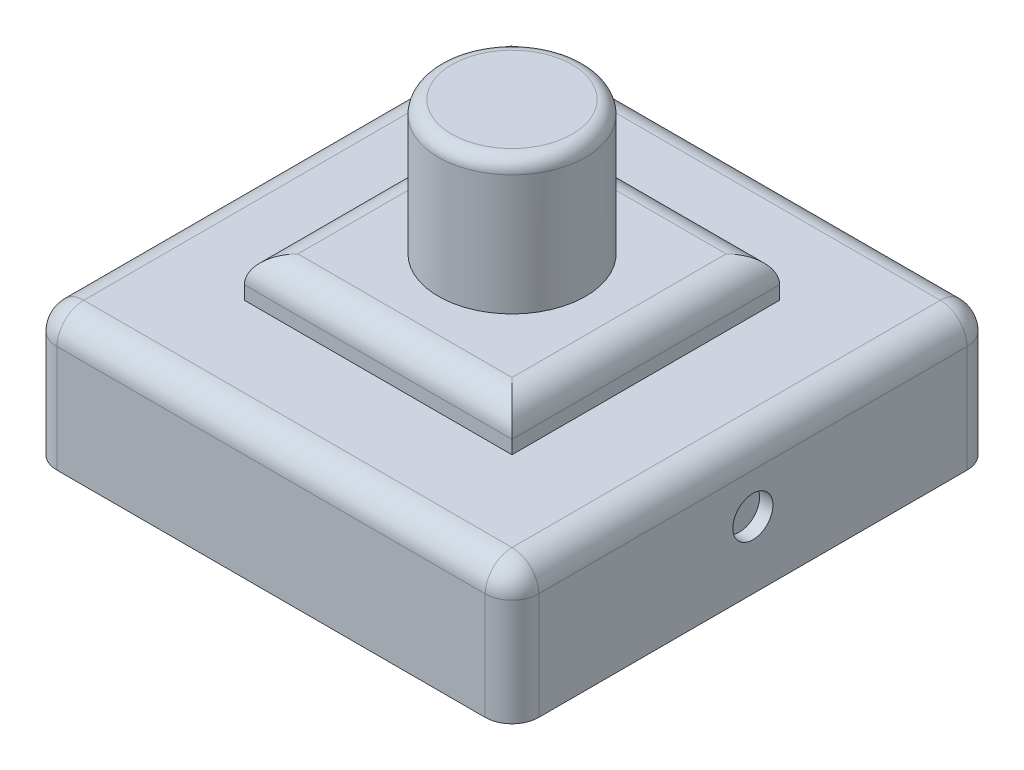
from build123d import *

# Parameters (mm, degrees)
SKETCH_1_W          = 36
SKETCH_1_H          = 36
EXTRUDE_1_DEPTH     = 10
SKETCH_2_W          = 20
SKETCH_2_H          = 20
EXTRUDE_2_DEPTH     = 3
SKETCH_3_R          = 5.5
EXTRUDE_4_DEPTH     = 10
SKETCH_4_R          = 1.5
CUT_EXTRUDE_1_DEPTH = 1
CUT_EXTRUDE_START   = -1
SKETCH_5_R          = 1.5
CUT_EXTRUDE_2_DEPTH = 1
FILLET_1_R          = 2
FILLET_2_R          = 1


with BuildPart() as part:
    # 草图1 → 凸台-拉伸1 (new body)
    with BuildSketch(Plane(origin=(0, 0, 0), x_dir=(1, 0, 0), z_dir=(0, 1, 0))):
        Rectangle(SKETCH_1_W, SKETCH_1_H)
    extrude(amount=-EXTRUDE_1_DEPTH)

    # 草图2 → 凸台-拉伸2 (add)
    with BuildSketch(Plane(origin=(0, 0, 0), x_dir=(1, 0, 0), z_dir=(0, 1, 0))):
        Rectangle(SKETCH_2_W, SKETCH_2_H)
    extrude(amount=EXTRUDE_2_DEPTH)

    # 草图3 → 凸台-拉伸4 (add)
    with BuildSketch(Plane(origin=(0, 3, 0), x_dir=(1, 0, 0), z_dir=(0, 1, 0))):
        with Locations(Location((0, 0, 0), (0, 0, 90))):
            Circle(SKETCH_3_R)
    extrude(amount=EXTRUDE_4_DEPTH)

    # 草图4 → 切除-拉伸1 (cut)
    with BuildSketch(Plane.ZY.offset(18)):
        with Locations((0, -5)):
            Circle(SKETCH_4_R)
    extrude(amount=-CUT_EXTRUDE_1_DEPTH, mode=Mode.SUBTRACT)

    # 草图5 → 切除-拉伸2 (cut)
    with BuildSketch(Plane(origin=(18, 0, 0), x_dir=(0, 0, -1), z_dir=(1, 0, 0)).offset(CUT_EXTRUDE_START)):
        with Locations(Location((0, -5, 0), (0, 0, 180))):
            Circle(SKETCH_5_R)
    extrude(amount=CUT_EXTRUDE_2_DEPTH, mode=Mode.SUBTRACT)

    # 圆角1
    fillet_1_edges = [part.edges().sort_by_distance(p)[0] for p in [
        (10, 3, 0),
        (0, 3, -10),
        (-10, 3, 0),
        (0, 3, 10),
        (0, 0, 18),
        (-18, 0, 0),
        (0, 0, -18),
        (18, 0, 0),
        (18, -5, 18),
        (-18, -5, 18),
        (-18, -5, -18),
        (18, -5, -18),
    ]]
    fillet(fillet_1_edges, radius=FILLET_1_R)

    # 圆角2
    fillet_2_edges = [part.edges().sort_by_distance(p)[0] for p in [
        (0, 13, 5.5),
    ]]
    fillet(fillet_2_edges, radius=FILLET_2_R)


solid = part.part
